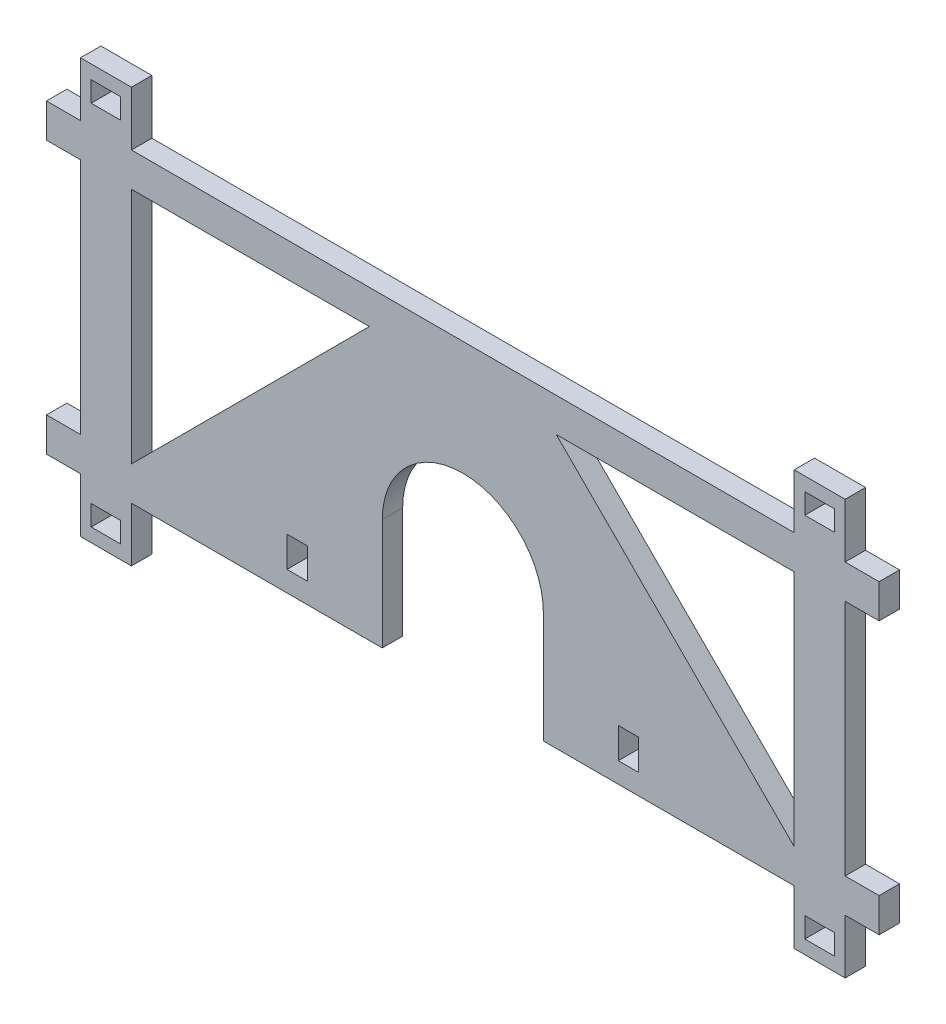
from build123d import *

# Parameters (mm, degrees)
BOSS_EXTRUDE1_DEPTH = 5.08
CUT_EXTRUDE2_DEPTH  = 219.330036922
CUT_EXTRUDE4_DEPTH  = 219.330036922
CUT_EXTRUDE5_DEPTH  = 219.330036922
CUT_EXTRUDE6_DEPTH  = 219.330036922


with BuildPart() as part:
    # Sketch1 → Boss-Extrude1 (new body)
    with BuildSketch(Plane.XY):
        Polygon((198.966666667, 76.2), (198.966666667, 67.733333333), (190.5, 67.733333333), (190.5, 8.466666667), (198.966666667, 8.466666667), (198.966666667, 0), (190.5, 0), (190.5, -13.546666667), (177.8, -13.546666667), (177.8, 0), (12.7, 0), (12.7, -13.546666667), (0, -13.546666667), (0, 0), (-8.466666667, 0), (-8.466666667, 8.466666667), (0, 8.466666667), (0, 67.733333333), (-8.466666667, 67.733333333), (-8.466666667, 76.2), (0, 76.2), (0, 89.746666667), (12.7, 89.746666667), (12.7, 76.2), (177.8, 76.2), (177.8, 89.746666667), (190.5, 89.746666667), (190.5, 76.2), align=None)
    extrude(amount=BOSS_EXTRUDE1_DEPTH)

    # Sketch2 → Cut-Extrude2 (cut, through all)
    with BuildSketch(Plane.XY.offset(5.08)):
        with BuildLine():
            Line((95.25, 0), (115.316, 0))
            Line((115.316, 0), (115.316, 27.686))
            ThreePointArc((115.316, 27.686), (95.25, 47.752), (75.184, 27.686))
            Line((75.184, 27.686), (75.184, 0))
            Line((75.184, 0), (95.25, 0))
        make_face()
    extrude(amount=-CUT_EXTRUDE2_DEPTH, mode=Mode.SUBTRACT)

    # Sketch3 → Cut-Extrude4 (cut, through all)
    with BuildSketch(Plane.XY.offset(5.08)):
        Polygon((6.35, 81.28), (10.033, 81.28), (10.033, 86.36), (2.667, 86.36), (2.667, 81.28), align=None)
        Polygon((184.15, 81.28), (187.833, 81.28), (187.833, 86.36), (180.467, 86.36), (180.467, 81.28), align=None)
        Polygon((184.15, -5.08), (187.833, -5.08), (187.833, -10.16), (180.467, -10.16), (180.467, -5.08), align=None)
        Polygon((6.35, -5.08), (10.033, -5.08), (10.033, -10.16), (2.667, -10.16), (2.667, -5.08), align=None)
    extrude(amount=-CUT_EXTRUDE4_DEPTH, mode=Mode.SUBTRACT)

    # Sketch4 → Cut-Extrude5 (cut, through all)
    with BuildSketch(Plane.XY.offset(5.08)):
        Polygon((136.525, 5.08), (139.065, 5.08), (139.065, 12.7), (133.985, 12.7), (133.985, 5.08), align=None)
        Polygon((53.975, 5.08), (56.515, 5.08), (56.515, 12.7), (51.435, 12.7), (51.435, 5.08), align=None)
    extrude(amount=-CUT_EXTRUDE5_DEPTH, mode=Mode.SUBTRACT)

    # Sketch5 → Cut-Extrude6 (cut, through all)
    with BuildSketch(Plane.XY.offset(5.08)):
        Polygon((12.7, 67.733333333), (12.7, 8.466666667), (71.966666667, 67.733333333), align=None)
    cut_extrude6 = extrude(amount=-CUT_EXTRUDE6_DEPTH, mode=Mode.SUBTRACT)

    # Mirror1: Cut-Extrude6 across plane
    add(cut_extrude6.mirror(Plane(origin=(95.25, 0, 0), x_dir=(0, 0, 1), z_dir=(1, 0, 0))), mode=Mode.SUBTRACT)


solid = part.part
